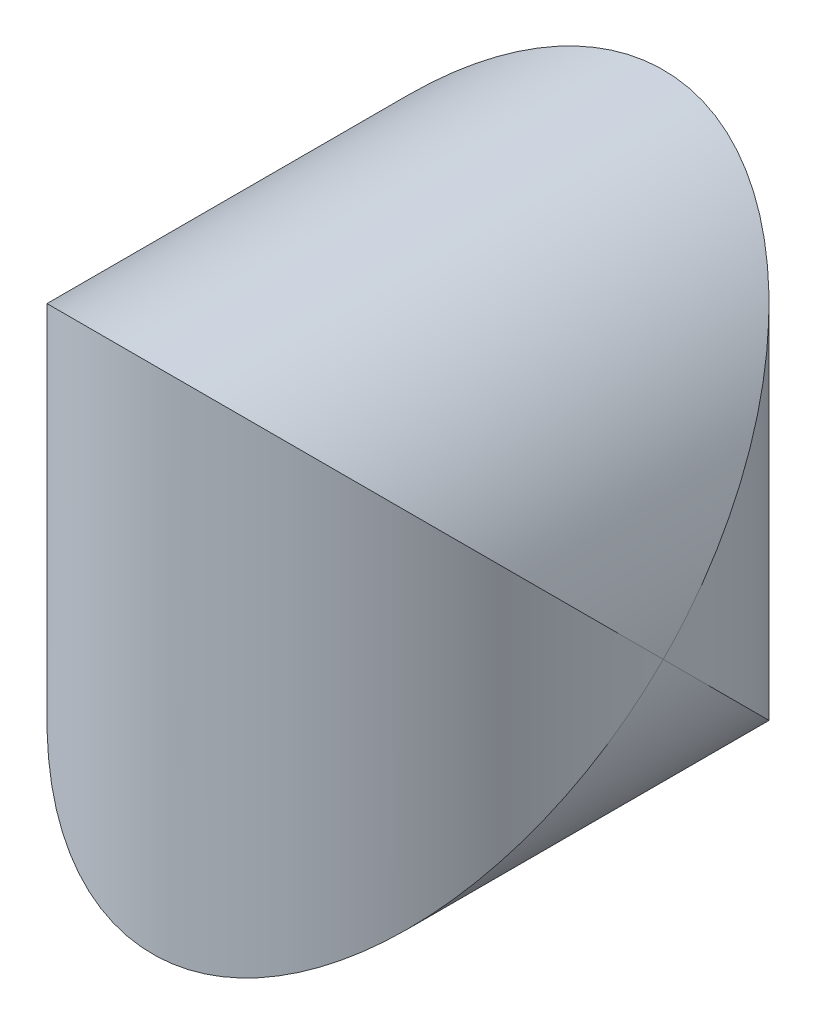
from build123d import *

# Parameters (mm, degrees)
SKETCH_1_R          = 15
EXTRUDE_1_DEPTH     = 15
SKETCH_2_OUTSIDE_W  = 42.392
SKETCH_2_OUTSIDE_H  = 42.392
SKETCH_2_OUTSIDE_R  = 15
CUT_EXTRUDE_1_DEPTH = 15


with BuildPart() as part:
    # 草图1 → 凸台-拉伸1 (new, symmetric)
    with BuildSketch(Plane.XY):
        Circle(SKETCH_1_R)
    extrude(amount=EXTRUDE_1_DEPTH, both=True)

    # 草图2 outside → 切除-拉伸1 (cut, symmetric)
    with BuildSketch(Plane(origin=(0, 0, 0), x_dir=(1, 0, 0), z_dir=(0, 1, 0))):
        Rectangle(SKETCH_2_OUTSIDE_W, SKETCH_2_OUTSIDE_H)
        Circle(SKETCH_2_OUTSIDE_R, mode=Mode.SUBTRACT)
    extrude(amount=CUT_EXTRUDE_1_DEPTH, both=True, mode=Mode.SUBTRACT)


solid = part.part
